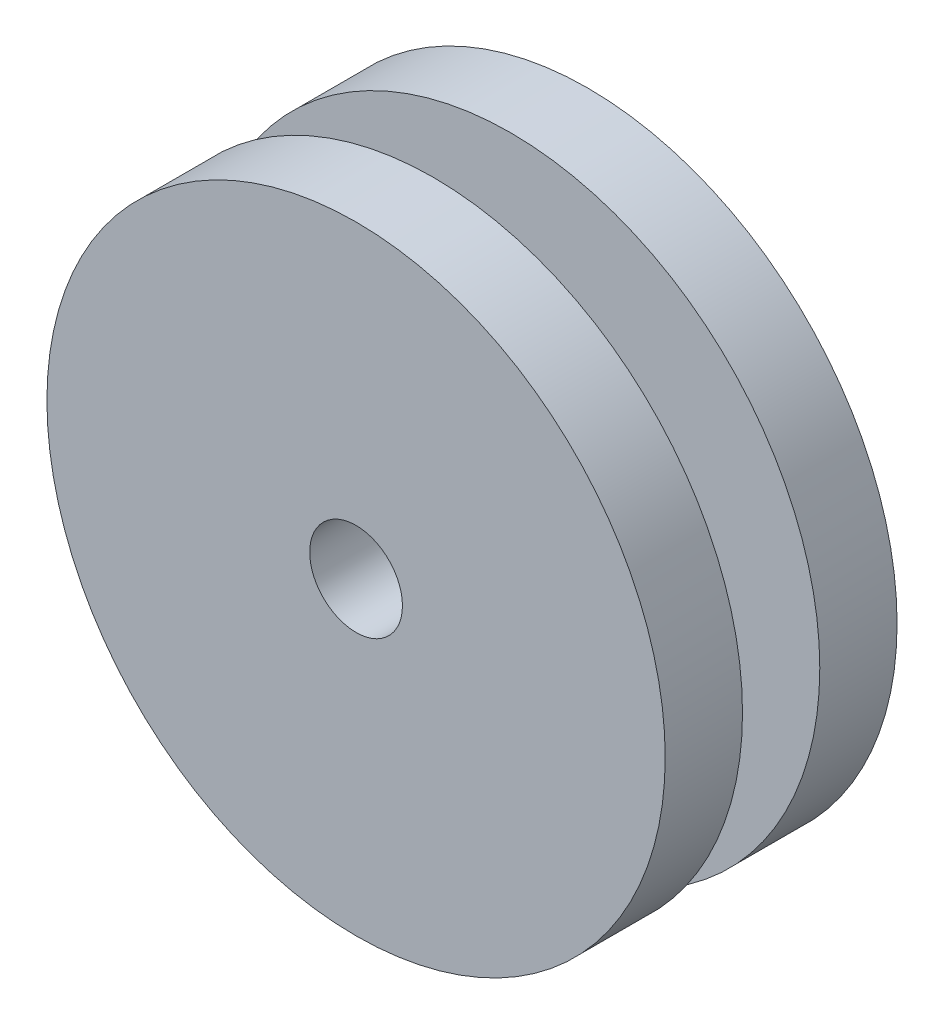
from build123d import *

# Parameters (mm, degrees)
SKETCH1_R           = 20
BOSS_EXTRUDE1_DEPTH = 5
SKETCH2_R           = 10
BOSS_EXTRUDE2_DEPTH = 5
SKETCH3_R           = 20
BOSS_EXTRUDE3_DEPTH = 5
SKETCH4_R           = 3
CUT_EXTRUDE1_DEPTH  = 33.015621187


with BuildPart() as part:
    # Sketch1 → Boss-Extrude1 (new body)
    with BuildSketch(Plane.XY):
        Circle(SKETCH1_R)
    extrude(amount=BOSS_EXTRUDE1_DEPTH)

    # Sketch2 → Boss-Extrude2 (add)
    with BuildSketch(Plane.XY.offset(5)):
        Circle(SKETCH2_R)
    extrude(amount=BOSS_EXTRUDE2_DEPTH)

    # Sketch3 → Boss-Extrude3 (add)
    with BuildSketch(Plane.XY.offset(10)):
        Circle(SKETCH3_R)
    extrude(amount=BOSS_EXTRUDE3_DEPTH)

    # Sketch4 → Cut-Extrude1 (cut, through all)
    with BuildSketch(Plane.XY.offset(15)):
        Circle(SKETCH4_R)
    extrude(amount=-CUT_EXTRUDE1_DEPTH, mode=Mode.SUBTRACT)


solid = part.part
